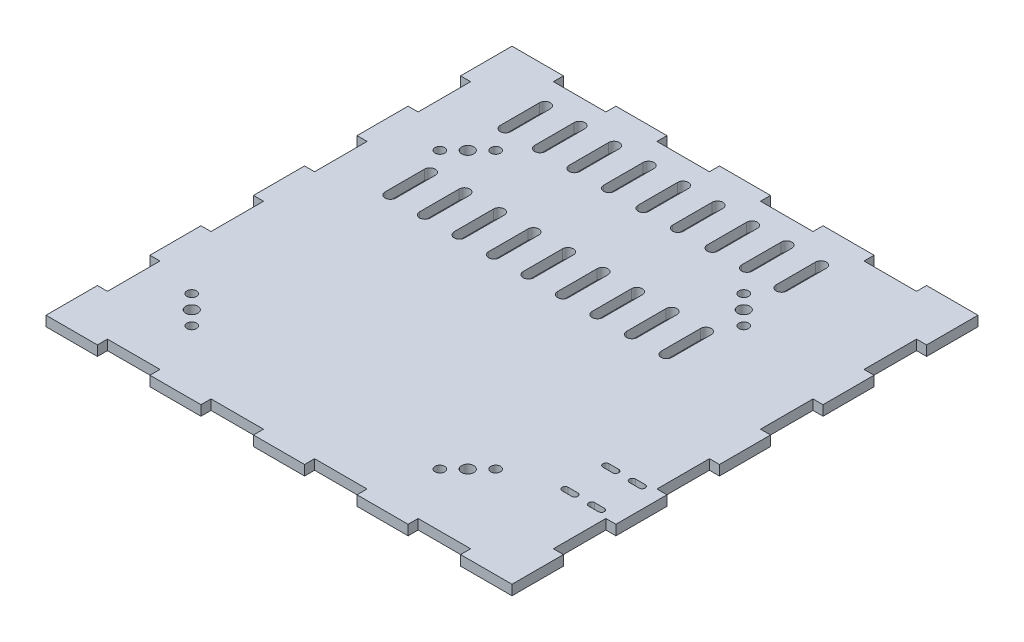
from build123d import *

# Parameters (mm, degrees)
SKETCH2_W           = 130
SKETCH2_H           = 130
SKETCH2_R           = 1.7
BOSS_EXTRUDE1_DEPTH = 2.8
CUT_EXTRUDE2_REACH  = 102.713
SKETCH5_R           = 1.35
SKETCH4_W           = 2.8
SKETCH4_H           = 14.444444445
SKETCH4_W_2         = 14.444444445
SKETCH4_H_2         = 2.8
CUT_EXTRUDE1_DEPTH  = 101.713020509
CUT_EXTRUDE3_REACH  = 102.713
CUT_EXTRUDE4_REACH  = 102.713
TOLERANCE_BY        = 0.1
TOLERANCE_2_BY      = 0.1
TOLERANCE_3_BY      = 0.1
TOLERANCE_4_BY      = 0.1
TOLERANCE_5_BY      = 0.1
TOLERANCE_6_BY      = 0.1
TOLERANCE_7_BY      = 0.1
TOLERANCE_8_BY      = 0.1
TOLERANCE_9_BY      = 0.1
TOLERANCE_10_BY     = 0.1
TOLERANCE_11_BY     = 0.1
TOLERANCE_12_BY     = 0.1
TOLERANCE_13_BY     = 0.1
TOLERANCE_14_BY     = 0.1
TOLERANCE_15_BY     = 0.1
TOLERANCE_16_BY     = 0.1
TOLERANCE_17_BY     = 0.1
TOLERANCE_18_BY     = 0.1
TOLERANCE_19_BY     = 0.1
TOLERANCE_20_BY     = 0.1
TOLERANCE_21_BY     = 0.1
TOLERANCE_22_BY     = 0.1
TOLERANCE_23_BY     = 0.1
TOLERANCE_24_BY     = 0.1
TOLERANCE_25_BY     = 0.1
TOLERANCE_26_BY     = 0.1
TOLERANCE_27_BY     = 0.1
TOLERANCE_28_BY     = 0.1
TOLERANCE_29_BY     = 0.1
TOLERANCE_30_BY     = 0.1
TOLERANCE_31_BY     = 0.1
TOLERANCE_32_BY     = 0.1


with BuildPart() as part:
    # Sketch2 → Boss-Extrude1 (new body)
    with BuildSketch(Plane(origin=(0, 0, 0), x_dir=(1, 0, 0), z_dir=(0, 1, 0))):
        with Locations((7.5, 4.85)):
            Rectangle(SKETCH2_W, SKETCH2_H)
        with Locations(Location((-38.5, 38.5, 0), (0, 0, 270))):
            Circle(SKETCH2_R, mode=Mode.SUBTRACT)
        with Locations(Location((-38.5, -38.5, 0), (0, 0, 270))):
            Circle(SKETCH2_R, mode=Mode.SUBTRACT)
        with Locations(Location((38.5, -38.5, 0), (0, 0, 270))):
            Circle(SKETCH2_R, mode=Mode.SUBTRACT)
        with Locations(Location((38.5, 38.5, 0), (0, 0, 270))):
            Circle(SKETCH2_R, mode=Mode.SUBTRACT)
    extrude(amount=BOSS_EXTRUDE1_DEPTH)

    # Sketch5 → Cut-Extrude2 (cut, up to next)
    with BuildSketch(Plane(origin=(0, 2.8, 0), x_dir=(1, 0, 0), z_dir=(0, 1, 0)), mode=Mode.PRIVATE) as cut_extrude2_sk1:
        with Locations(Location((42.389087297, 34.610912703, 0), (0, 0, 270))):
            Circle(SKETCH5_R)
    cut_extrude2_tool1 = extrude(cut_extrude2_sk1.sketch, amount=-CUT_EXTRUDE2_REACH, mode=Mode.PRIVATE) & part.part
    # Sketch5 → Cut-Extrude2 (cut, up to next)
    with BuildSketch(Plane(origin=(0, 2.8, 0), x_dir=(1, 0, 0), z_dir=(0, 1, 0)), mode=Mode.PRIVATE) as cut_extrude2_sk2:
        with Locations(Location((34.610912703, 42.389087297, 0), (0, 0, 270))):
            Circle(SKETCH5_R)
    cut_extrude2_tool2 = extrude(cut_extrude2_sk2.sketch, amount=-CUT_EXTRUDE2_REACH, mode=Mode.PRIVATE) & part.part
    # Sketch5 → Cut-Extrude2 (cut, up to next)
    with BuildSketch(Plane(origin=(0, 2.8, 0), x_dir=(1, 0, 0), z_dir=(0, 1, 0)), mode=Mode.PRIVATE) as cut_extrude2_sk3:
        with Locations(Location((34.610912703, -42.389087297, 0), (0, 0, 270))):
            Circle(SKETCH5_R)
    cut_extrude2_tool3 = extrude(cut_extrude2_sk3.sketch, amount=-CUT_EXTRUDE2_REACH, mode=Mode.PRIVATE) & part.part
    # Sketch5 → Cut-Extrude2 (cut, up to next)
    with BuildSketch(Plane(origin=(0, 2.8, 0), x_dir=(1, 0, 0), z_dir=(0, 1, 0)), mode=Mode.PRIVATE) as cut_extrude2_sk4:
        with Locations(Location((42.389087297, -34.610912703, 0), (0, 0, 270))):
            Circle(SKETCH5_R)
    cut_extrude2_tool4 = extrude(cut_extrude2_sk4.sketch, amount=-CUT_EXTRUDE2_REACH, mode=Mode.PRIVATE) & part.part
    # Sketch5 → Cut-Extrude2 (cut, up to next)
    with BuildSketch(Plane(origin=(0, 2.8, 0), x_dir=(1, 0, 0), z_dir=(0, 1, 0)), mode=Mode.PRIVATE) as cut_extrude2_sk5:
        with Locations(Location((-42.389087297, -34.610912703, 0), (0, 0, 270))):
            Circle(SKETCH5_R)
    cut_extrude2_tool5 = extrude(cut_extrude2_sk5.sketch, amount=-CUT_EXTRUDE2_REACH, mode=Mode.PRIVATE) & part.part
    # Sketch5 → Cut-Extrude2 (cut, up to next)
    with BuildSketch(Plane(origin=(0, 2.8, 0), x_dir=(1, 0, 0), z_dir=(0, 1, 0)), mode=Mode.PRIVATE) as cut_extrude2_sk6:
        with Locations(Location((-34.610912703, -42.389087297, 0), (0, 0, 270))):
            Circle(SKETCH5_R)
    cut_extrude2_tool6 = extrude(cut_extrude2_sk6.sketch, amount=-CUT_EXTRUDE2_REACH, mode=Mode.PRIVATE) & part.part
    # Sketch5 → Cut-Extrude2 (cut, up to next)
    with BuildSketch(Plane(origin=(0, 2.8, 0), x_dir=(1, 0, 0), z_dir=(0, 1, 0)), mode=Mode.PRIVATE) as cut_extrude2_sk7:
        with Locations(Location((-34.610912703, 42.389087297, 0), (0, 0, 270))):
            Circle(SKETCH5_R)
    cut_extrude2_tool7 = extrude(cut_extrude2_sk7.sketch, amount=-CUT_EXTRUDE2_REACH, mode=Mode.PRIVATE) & part.part
    # Sketch5 → Cut-Extrude2 (cut, up to next)
    with BuildSketch(Plane(origin=(0, 2.8, 0), x_dir=(1, 0, 0), z_dir=(0, 1, 0)), mode=Mode.PRIVATE) as cut_extrude2_sk8:
        with Locations(Location((-42.389087297, 34.610912703, 0), (0, 0, 270))):
            Circle(SKETCH5_R)
    cut_extrude2_tool8 = extrude(cut_extrude2_sk8.sketch, amount=-CUT_EXTRUDE2_REACH, mode=Mode.PRIVATE) & part.part
    add(cut_extrude2_tool1.solids().sort_by_distance((42.389087, 2.8, -34.610913))[0], mode=Mode.SUBTRACT)
    add(cut_extrude2_tool2.solids().sort_by_distance((34.610913, 2.8, -42.389087))[0], mode=Mode.SUBTRACT)
    add(cut_extrude2_tool3.solids().sort_by_distance((34.610913, 2.8, 42.389087))[0], mode=Mode.SUBTRACT)
    add(cut_extrude2_tool4.solids().sort_by_distance((42.389087, 2.8, 34.610913))[0], mode=Mode.SUBTRACT)
    add(cut_extrude2_tool5.solids().sort_by_distance((-42.389087, 2.8, 34.610913))[0], mode=Mode.SUBTRACT)
    add(cut_extrude2_tool6.solids().sort_by_distance((-34.610913, 2.8, 42.389087))[0], mode=Mode.SUBTRACT)
    add(cut_extrude2_tool7.solids().sort_by_distance((-34.610913, 2.8, -42.389087))[0], mode=Mode.SUBTRACT)
    add(cut_extrude2_tool8.solids().sort_by_distance((-42.389087, 2.8, -34.610913))[0], mode=Mode.SUBTRACT)

    # Sketch4 → Cut-Extrude1 (cut, through all)
    with BuildSketch(Plane(origin=(0, 2.8, 0), x_dir=(1, 0, 0), z_dir=(0, 1, 0))):
        with Locations((71.1, 48.183333334)):
            Rectangle(SKETCH4_W, SKETCH4_H)
        with Locations((71.1, 19.294444445)):
            Rectangle(SKETCH4_W, SKETCH4_H)
        with Locations((71.1, -9.594444445)):
            Rectangle(SKETCH4_W, SKETCH4_H)
        with Locations((71.1, -38.483333333)):
            Rectangle(SKETCH4_W, SKETCH4_H)
        with Locations((-35.833333334, -58.75)):
            Rectangle(SKETCH4_W_2, SKETCH4_H_2)
        with Locations((-6.944444445, -58.75)):
            Rectangle(SKETCH4_W_2, SKETCH4_H_2)
        with Locations((21.944444445, -58.75)):
            Rectangle(SKETCH4_W_2, SKETCH4_H_2)
        with Locations((50.833333334, -58.75)):
            Rectangle(SKETCH4_W_2, SKETCH4_H_2)
        with Locations((-56.1, 48.183333334)):
            Rectangle(SKETCH4_W, SKETCH4_H)
        with Locations((-56.1, 19.294444445)):
            Rectangle(SKETCH4_W, SKETCH4_H)
        with Locations((-56.1, -9.594444445)):
            Rectangle(SKETCH4_W, SKETCH4_H)
        with Locations((-56.1, -38.483333333)):
            Rectangle(SKETCH4_W, SKETCH4_H)
        with Locations((50.833333334, 68.45)):
            Rectangle(SKETCH4_W_2, SKETCH4_H_2)
        with Locations((21.944444445, 68.45)):
            Rectangle(SKETCH4_W_2, SKETCH4_H_2)
        with Locations((-6.944444445, 68.45)):
            Rectangle(SKETCH4_W_2, SKETCH4_H_2)
        with Locations((-35.833333334, 68.45)):
            Rectangle(SKETCH4_W_2, SKETCH4_H_2)
    extrude(amount=-CUT_EXTRUDE1_DEPTH, mode=Mode.SUBTRACT)

    # Sketch6 → Cut-Extrude3 (cut, up to next)
    with BuildSketch(Plane(origin=(0, 2.8, 0), x_dir=(1, 0, 0), z_dir=(0, 1, 0)), mode=Mode.PRIVATE) as cut_extrude3_sk1:
        with BuildLine():
            Line((67, -30.588888889), (64.3, -30.588888889))
            ThreePointArc((64.3, -30.588888889), (63.45, -29.738888889), (64.3, -28.888888889))
            Line((64.3, -28.888888889), (67, -28.888888889))
            ThreePointArc((67, -28.888888889), (67.85, -29.738888889), (67, -30.588888889))
        make_face()
    cut_extrude3_tool1 = extrude(cut_extrude3_sk1.sketch, amount=-CUT_EXTRUDE3_REACH, mode=Mode.PRIVATE) & part.part
    # Sketch6 → Cut-Extrude3 (cut, up to next)
    with BuildSketch(Plane(origin=(0, 2.8, 0), x_dir=(1, 0, 0), z_dir=(0, 1, 0)), mode=Mode.PRIVATE) as cut_extrude3_sk2:
        with BuildLine():
            Line((59.6, -30.588888889), (56.9, -30.588888889))
            ThreePointArc((56.9, -30.588888889), (56.05, -29.738888889), (56.9, -28.888888889))
            Line((56.9, -28.888888889), (59.6, -28.888888889))
            ThreePointArc((59.6, -28.888888889), (60.45, -29.738888889), (59.6, -30.588888889))
        make_face()
    cut_extrude3_tool2 = extrude(cut_extrude3_sk2.sketch, amount=-CUT_EXTRUDE3_REACH, mode=Mode.PRIVATE) & part.part
    # Sketch6 → Cut-Extrude3 (cut, up to next)
    with BuildSketch(Plane(origin=(0, 2.8, 0), x_dir=(1, 0, 0), z_dir=(0, 1, 0)), mode=Mode.PRIVATE) as cut_extrude3_sk3:
        with BuildLine():
            Line((59.6, -17.488888889), (56.9, -17.488888889))
            ThreePointArc((56.9, -17.488888889), (56.05, -18.338888889), (56.9, -19.188888889))
            Line((56.9, -19.188888889), (59.6, -19.188888889))
            ThreePointArc((59.6, -19.188888889), (60.45, -18.338888889), (59.6, -17.488888889))
        make_face()
    cut_extrude3_tool3 = extrude(cut_extrude3_sk3.sketch, amount=-CUT_EXTRUDE3_REACH, mode=Mode.PRIVATE) & part.part
    # Sketch6 → Cut-Extrude3 (cut, up to next)
    with BuildSketch(Plane(origin=(0, 2.8, 0), x_dir=(1, 0, 0), z_dir=(0, 1, 0)), mode=Mode.PRIVATE) as cut_extrude3_sk4:
        with BuildLine():
            Line((67, -17.488888889), (64.3, -17.488888889))
            ThreePointArc((64.3, -17.488888889), (63.45, -18.338888889), (64.3, -19.188888889))
            Line((64.3, -19.188888889), (67, -19.188888889))
            ThreePointArc((67, -19.188888889), (67.85, -18.338888889), (67, -17.488888889))
        make_face()
    cut_extrude3_tool4 = extrude(cut_extrude3_sk4.sketch, amount=-CUT_EXTRUDE3_REACH, mode=Mode.PRIVATE) & part.part
    add(cut_extrude3_tool1.solids().sort_by_distance((65.65, 2.8, 29.738889))[0], mode=Mode.SUBTRACT)
    add(cut_extrude3_tool2.solids().sort_by_distance((58.25, 2.8, 29.738889))[0], mode=Mode.SUBTRACT)
    add(cut_extrude3_tool3.solids().sort_by_distance((58.25, 2.8, 18.338889))[0], mode=Mode.SUBTRACT)
    add(cut_extrude3_tool4.solids().sort_by_distance((65.65, 2.8, 18.338889))[0], mode=Mode.SUBTRACT)

    # Sketch7 → Cut-Extrude4 (cut, up to next)
    with BuildSketch(Plane(origin=(0, 2.8, 0), x_dir=(1, 0, 0), z_dir=(0, 1, 0)), mode=Mode.PRIVATE) as cut_extrude4_sk1:
        with BuildLine():
            Line((-37, 60.05), (-37, 49.05))
            ThreePointArc((-37, 49.05), (-38.5, 47.55), (-40, 49.05))
            Line((-40, 49.05), (-40, 60.05))
            ThreePointArc((-40, 60.05), (-38.5, 61.55), (-37, 60.05))
        make_face()
    cut_extrude4_tool1 = extrude(cut_extrude4_sk1.sketch, amount=-CUT_EXTRUDE4_REACH, mode=Mode.PRIVATE) & part.part
    # Sketch7 → Cut-Extrude4 (cut, up to next)
    with BuildSketch(Plane(origin=(0, 2.8, 0), x_dir=(1, 0, 0), z_dir=(0, 1, 0)), mode=Mode.PRIVATE) as cut_extrude4_sk2:
        with BuildLine():
            Line((-30.375, 60.05), (-30.375, 49.05))
            ThreePointArc((-30.375, 49.05), (-28.875, 47.55), (-27.375, 49.05))
            Line((-27.375, 49.05), (-27.375, 60.05))
            ThreePointArc((-27.375, 60.05), (-28.875, 61.55), (-30.375, 60.05))
        make_face()
    cut_extrude4_tool2 = extrude(cut_extrude4_sk2.sketch, amount=-CUT_EXTRUDE4_REACH, mode=Mode.PRIVATE) & part.part
    # Sketch7 → Cut-Extrude4 (cut, up to next)
    with BuildSketch(Plane(origin=(0, 2.8, 0), x_dir=(1, 0, 0), z_dir=(0, 1, 0)), mode=Mode.PRIVATE) as cut_extrude4_sk3:
        with BuildLine():
            Line((-20.75, 60.05), (-20.75, 49.05))
            ThreePointArc((-20.75, 49.05), (-19.25, 47.55), (-17.75, 49.05))
            Line((-17.75, 49.05), (-17.75, 60.05))
            ThreePointArc((-17.75, 60.05), (-19.25, 61.55), (-20.75, 60.05))
        make_face()
    cut_extrude4_tool3 = extrude(cut_extrude4_sk3.sketch, amount=-CUT_EXTRUDE4_REACH, mode=Mode.PRIVATE) & part.part
    # Sketch7 → Cut-Extrude4 (cut, up to next)
    with BuildSketch(Plane(origin=(0, 2.8, 0), x_dir=(1, 0, 0), z_dir=(0, 1, 0)), mode=Mode.PRIVATE) as cut_extrude4_sk4:
        with BuildLine():
            Line((-11.125, 60.05), (-11.125, 49.05))
            ThreePointArc((-11.125, 49.05), (-9.625, 47.55), (-8.125, 49.05))
            Line((-8.125, 49.05), (-8.125, 60.05))
            ThreePointArc((-8.125, 60.05), (-9.625, 61.55), (-11.125, 60.05))
        make_face()
    cut_extrude4_tool4 = extrude(cut_extrude4_sk4.sketch, amount=-CUT_EXTRUDE4_REACH, mode=Mode.PRIVATE) & part.part
    # Sketch7 → Cut-Extrude4 (cut, up to next)
    with BuildSketch(Plane(origin=(0, 2.8, 0), x_dir=(1, 0, 0), z_dir=(0, 1, 0)), mode=Mode.PRIVATE) as cut_extrude4_sk5:
        with BuildLine():
            Line((-1.5, 60.05), (-1.5, 49.05))
            ThreePointArc((-1.5, 49.05), (0, 47.55), (1.5, 49.05))
            Line((1.5, 49.05), (1.5, 60.05))
            ThreePointArc((1.5, 60.05), (0, 61.55), (-1.5, 60.05))
        make_face()
    cut_extrude4_tool5 = extrude(cut_extrude4_sk5.sketch, amount=-CUT_EXTRUDE4_REACH, mode=Mode.PRIVATE) & part.part
    # Sketch7 → Cut-Extrude4 (cut, up to next)
    with BuildSketch(Plane(origin=(0, 2.8, 0), x_dir=(1, 0, 0), z_dir=(0, 1, 0)), mode=Mode.PRIVATE) as cut_extrude4_sk6:
        with BuildLine():
            Line((8.125, 60.05), (8.125, 49.05))
            ThreePointArc((8.125, 49.05), (9.625, 47.55), (11.125, 49.05))
            Line((11.125, 49.05), (11.125, 60.05))
            ThreePointArc((11.125, 60.05), (9.625, 61.55), (8.125, 60.05))
        make_face()
    cut_extrude4_tool6 = extrude(cut_extrude4_sk6.sketch, amount=-CUT_EXTRUDE4_REACH, mode=Mode.PRIVATE) & part.part
    # Sketch7 → Cut-Extrude4 (cut, up to next)
    with BuildSketch(Plane(origin=(0, 2.8, 0), x_dir=(1, 0, 0), z_dir=(0, 1, 0)), mode=Mode.PRIVATE) as cut_extrude4_sk7:
        with BuildLine():
            Line((17.75, 60.05), (17.75, 49.05))
            ThreePointArc((17.75, 49.05), (19.25, 47.55), (20.75, 49.05))
            Line((20.75, 49.05), (20.75, 60.05))
            ThreePointArc((20.75, 60.05), (19.25, 61.55), (17.75, 60.05))
        make_face()
    cut_extrude4_tool7 = extrude(cut_extrude4_sk7.sketch, amount=-CUT_EXTRUDE4_REACH, mode=Mode.PRIVATE) & part.part
    # Sketch7 → Cut-Extrude4 (cut, up to next)
    with BuildSketch(Plane(origin=(0, 2.8, 0), x_dir=(1, 0, 0), z_dir=(0, 1, 0)), mode=Mode.PRIVATE) as cut_extrude4_sk8:
        with BuildLine():
            Line((27.375, 60.05), (27.375, 49.05))
            ThreePointArc((27.375, 49.05), (28.875, 47.55), (30.375, 49.05))
            Line((30.375, 49.05), (30.375, 60.05))
            ThreePointArc((30.375, 60.05), (28.875, 61.55), (27.375, 60.05))
        make_face()
    cut_extrude4_tool8 = extrude(cut_extrude4_sk8.sketch, amount=-CUT_EXTRUDE4_REACH, mode=Mode.PRIVATE) & part.part
    # Sketch7 → Cut-Extrude4 (cut, up to next)
    with BuildSketch(Plane(origin=(0, 2.8, 0), x_dir=(1, 0, 0), z_dir=(0, 1, 0)), mode=Mode.PRIVATE) as cut_extrude4_sk9:
        with BuildLine():
            Line((37, 60.05), (37, 49.05))
            ThreePointArc((37, 49.05), (38.5, 47.55), (40, 49.05))
            Line((40, 49.05), (40, 60.05))
            ThreePointArc((40, 60.05), (38.5, 61.55), (37, 60.05))
        make_face()
    cut_extrude4_tool9 = extrude(cut_extrude4_sk9.sketch, amount=-CUT_EXTRUDE4_REACH, mode=Mode.PRIVATE) & part.part
    # Sketch7 → Cut-Extrude4 (cut, up to next)
    with BuildSketch(Plane(origin=(0, 2.8, 0), x_dir=(1, 0, 0), z_dir=(0, 1, 0)), mode=Mode.PRIVATE) as cut_extrude4_sk10:
        with BuildLine():
            Line((-40, 27.95), (-40, 16.95))
            ThreePointArc((-40, 16.95), (-38.5, 15.45), (-37, 16.95))
            Line((-37, 16.95), (-37, 27.95))
            ThreePointArc((-37, 27.95), (-38.5, 29.45), (-40, 27.95))
        make_face()
    cut_extrude4_tool10 = extrude(cut_extrude4_sk10.sketch, amount=-CUT_EXTRUDE4_REACH, mode=Mode.PRIVATE) & part.part
    # Sketch7 → Cut-Extrude4 (cut, up to next)
    with BuildSketch(Plane(origin=(0, 2.8, 0), x_dir=(1, 0, 0), z_dir=(0, 1, 0)), mode=Mode.PRIVATE) as cut_extrude4_sk11:
        with BuildLine():
            Line((-30.375, 27.95), (-30.375, 16.95))
            ThreePointArc((-30.375, 16.95), (-28.875, 15.45), (-27.375, 16.95))
            Line((-27.375, 16.95), (-27.375, 27.95))
            ThreePointArc((-27.375, 27.95), (-28.875, 29.45), (-30.375, 27.95))
        make_face()
    cut_extrude4_tool11 = extrude(cut_extrude4_sk11.sketch, amount=-CUT_EXTRUDE4_REACH, mode=Mode.PRIVATE) & part.part
    # Sketch7 → Cut-Extrude4 (cut, up to next)
    with BuildSketch(Plane(origin=(0, 2.8, 0), x_dir=(1, 0, 0), z_dir=(0, 1, 0)), mode=Mode.PRIVATE) as cut_extrude4_sk12:
        with BuildLine():
            Line((-20.75, 27.95), (-20.75, 16.95))
            ThreePointArc((-20.75, 16.95), (-19.25, 15.45), (-17.75, 16.95))
            Line((-17.75, 16.95), (-17.75, 27.95))
            ThreePointArc((-17.75, 27.95), (-19.25, 29.45), (-20.75, 27.95))
        make_face()
    cut_extrude4_tool12 = extrude(cut_extrude4_sk12.sketch, amount=-CUT_EXTRUDE4_REACH, mode=Mode.PRIVATE) & part.part
    # Sketch7 → Cut-Extrude4 (cut, up to next)
    with BuildSketch(Plane(origin=(0, 2.8, 0), x_dir=(1, 0, 0), z_dir=(0, 1, 0)), mode=Mode.PRIVATE) as cut_extrude4_sk13:
        with BuildLine():
            Line((-11.125, 27.95), (-11.125, 16.95))
            ThreePointArc((-11.125, 16.95), (-9.625, 15.45), (-8.125, 16.95))
            Line((-8.125, 16.95), (-8.125, 27.95))
            ThreePointArc((-8.125, 27.95), (-9.625, 29.45), (-11.125, 27.95))
        make_face()
    cut_extrude4_tool13 = extrude(cut_extrude4_sk13.sketch, amount=-CUT_EXTRUDE4_REACH, mode=Mode.PRIVATE) & part.part
    # Sketch7 → Cut-Extrude4 (cut, up to next)
    with BuildSketch(Plane(origin=(0, 2.8, 0), x_dir=(1, 0, 0), z_dir=(0, 1, 0)), mode=Mode.PRIVATE) as cut_extrude4_sk14:
        with BuildLine():
            Line((-1.5, 27.95), (-1.5, 16.95))
            ThreePointArc((-1.5, 16.95), (0, 15.45), (1.5, 16.95))
            Line((1.5, 16.95), (1.5, 27.95))
            ThreePointArc((1.5, 27.95), (0, 29.45), (-1.5, 27.95))
        make_face()
    cut_extrude4_tool14 = extrude(cut_extrude4_sk14.sketch, amount=-CUT_EXTRUDE4_REACH, mode=Mode.PRIVATE) & part.part
    # Sketch7 → Cut-Extrude4 (cut, up to next)
    with BuildSketch(Plane(origin=(0, 2.8, 0), x_dir=(1, 0, 0), z_dir=(0, 1, 0)), mode=Mode.PRIVATE) as cut_extrude4_sk15:
        with BuildLine():
            Line((8.125, 27.95), (8.125, 16.95))
            ThreePointArc((8.125, 16.95), (9.625, 15.45), (11.125, 16.95))
            Line((11.125, 16.95), (11.125, 27.95))
            ThreePointArc((11.125, 27.95), (9.625, 29.45), (8.125, 27.95))
        make_face()
    cut_extrude4_tool15 = extrude(cut_extrude4_sk15.sketch, amount=-CUT_EXTRUDE4_REACH, mode=Mode.PRIVATE) & part.part
    # Sketch7 → Cut-Extrude4 (cut, up to next)
    with BuildSketch(Plane(origin=(0, 2.8, 0), x_dir=(1, 0, 0), z_dir=(0, 1, 0)), mode=Mode.PRIVATE) as cut_extrude4_sk16:
        with BuildLine():
            Line((17.75, 27.95), (17.75, 16.95))
            ThreePointArc((17.75, 16.95), (19.25, 15.45), (20.75, 16.95))
            Line((20.75, 16.95), (20.75, 27.95))
            ThreePointArc((20.75, 27.95), (19.25, 29.45), (17.75, 27.95))
        make_face()
    cut_extrude4_tool16 = extrude(cut_extrude4_sk16.sketch, amount=-CUT_EXTRUDE4_REACH, mode=Mode.PRIVATE) & part.part
    # Sketch7 → Cut-Extrude4 (cut, up to next)
    with BuildSketch(Plane(origin=(0, 2.8, 0), x_dir=(1, 0, 0), z_dir=(0, 1, 0)), mode=Mode.PRIVATE) as cut_extrude4_sk17:
        with BuildLine():
            Line((27.375, 27.95), (27.375, 16.95))
            ThreePointArc((27.375, 16.95), (28.875, 15.45), (30.375, 16.95))
            Line((30.375, 16.95), (30.375, 27.95))
            ThreePointArc((30.375, 27.95), (28.875, 29.45), (27.375, 27.95))
        make_face()
    cut_extrude4_tool17 = extrude(cut_extrude4_sk17.sketch, amount=-CUT_EXTRUDE4_REACH, mode=Mode.PRIVATE) & part.part
    # Sketch7 → Cut-Extrude4 (cut, up to next)
    with BuildSketch(Plane(origin=(0, 2.8, 0), x_dir=(1, 0, 0), z_dir=(0, 1, 0)), mode=Mode.PRIVATE) as cut_extrude4_sk18:
        with BuildLine():
            Line((37, 27.95), (37, 16.95))
            ThreePointArc((37, 16.95), (38.5, 15.45), (40, 16.95))
            Line((40, 16.95), (40, 27.95))
            ThreePointArc((40, 27.95), (38.5, 29.45), (37, 27.95))
        make_face()
    cut_extrude4_tool18 = extrude(cut_extrude4_sk18.sketch, amount=-CUT_EXTRUDE4_REACH, mode=Mode.PRIVATE) & part.part
    add(cut_extrude4_tool1.solids().sort_by_distance((-38.5, 2.8, -54.55))[0], mode=Mode.SUBTRACT)
    add(cut_extrude4_tool2.solids().sort_by_distance((-28.875, 2.8, -54.55))[0], mode=Mode.SUBTRACT)
    add(cut_extrude4_tool3.solids().sort_by_distance((-19.25, 2.8, -54.55))[0], mode=Mode.SUBTRACT)
    add(cut_extrude4_tool4.solids().sort_by_distance((-9.625, 2.8, -54.55))[0], mode=Mode.SUBTRACT)
    add(cut_extrude4_tool5.solids().sort_by_distance((0, 2.8, -54.55))[0], mode=Mode.SUBTRACT)
    add(cut_extrude4_tool6.solids().sort_by_distance((9.625, 2.8, -54.55))[0], mode=Mode.SUBTRACT)
    add(cut_extrude4_tool7.solids().sort_by_distance((19.25, 2.8, -54.55))[0], mode=Mode.SUBTRACT)
    add(cut_extrude4_tool8.solids().sort_by_distance((28.875, 2.8, -54.55))[0], mode=Mode.SUBTRACT)
    add(cut_extrude4_tool9.solids().sort_by_distance((38.5, 2.8, -54.55))[0], mode=Mode.SUBTRACT)
    add(cut_extrude4_tool10.solids().sort_by_distance((-38.5, 2.8, -22.45))[0], mode=Mode.SUBTRACT)
    add(cut_extrude4_tool11.solids().sort_by_distance((-28.875, 2.8, -22.45))[0], mode=Mode.SUBTRACT)
    add(cut_extrude4_tool12.solids().sort_by_distance((-19.25, 2.8, -22.45))[0], mode=Mode.SUBTRACT)
    add(cut_extrude4_tool13.solids().sort_by_distance((-9.625, 2.8, -22.45))[0], mode=Mode.SUBTRACT)
    add(cut_extrude4_tool14.solids().sort_by_distance((0, 2.8, -22.45))[0], mode=Mode.SUBTRACT)
    add(cut_extrude4_tool15.solids().sort_by_distance((9.625, 2.8, -22.45))[0], mode=Mode.SUBTRACT)
    add(cut_extrude4_tool16.solids().sort_by_distance((19.25, 2.8, -22.45))[0], mode=Mode.SUBTRACT)
    add(cut_extrude4_tool17.solids().sort_by_distance((28.875, 2.8, -22.45))[0], mode=Mode.SUBTRACT)
    add(cut_extrude4_tool18.solids().sort_by_distance((38.5, 2.8, -22.45))[0], mode=Mode.SUBTRACT)

    # Tolerance: a face moved inward by 0.1
    extrude(part.faces().sort_by_distance((43.611111111, 1.4, -68.45))[0], amount=TOLERANCE_BY, dir=(-1, 0, 0), mode=Mode.SUBTRACT)

    # Tolerance 2: a face moved inward by 0.1
    extrude(part.faces().sort_by_distance((14.722222222, 1.4, -68.45))[0], amount=TOLERANCE_2_BY, dir=(-1, 0, 0), mode=Mode.SUBTRACT)

    # Tolerance 3: a face moved inward by 0.1
    extrude(part.faces().sort_by_distance((-14.166666667, 1.4, -68.45))[0], amount=TOLERANCE_3_BY, dir=(-1, 0, 0), mode=Mode.SUBTRACT)

    # Tolerance 4: a face moved inward by 0.1
    extrude(part.faces().sort_by_distance((-43.055555556, 1.4, -68.45))[0], amount=TOLERANCE_4_BY, dir=(-1, 0, 0), mode=Mode.SUBTRACT)

    # Tolerance 5: a face moved inward by 0.1
    extrude(part.faces().sort_by_distance((29.166666667, 1.4, -68.45))[0], amount=TOLERANCE_5_BY, dir=(1, 0, 0), mode=Mode.SUBTRACT)

    # Tolerance 6: a face moved inward by 0.1
    extrude(part.faces().sort_by_distance((58.055555556, 1.4, -68.45))[0], amount=TOLERANCE_6_BY, dir=(1, 0, 0), mode=Mode.SUBTRACT)

    # Tolerance 7: a face moved inward by 0.1
    extrude(part.faces().sort_by_distance((0.277777778, 1.4, -68.45))[0], amount=TOLERANCE_7_BY, dir=(1, 0, 0), mode=Mode.SUBTRACT)

    # Tolerance 8: a face moved inward by 0.1
    extrude(part.faces().sort_by_distance((-28.611111111, 1.4, -68.45))[0], amount=TOLERANCE_8_BY, dir=(1, 0, 0), mode=Mode.SUBTRACT)

    # Tolerance 9: a face moved inward by 0.1
    extrude(part.faces().sort_by_distance((-56.1, 1.4, -40.961111111))[0], amount=TOLERANCE_9_BY, dir=(0, 0, 1), mode=Mode.SUBTRACT)

    # Tolerance 10: a face moved inward by 0.1
    extrude(part.faces().sort_by_distance((-56.1, 1.4, -55.405555556))[0], amount=TOLERANCE_10_BY, dir=(0, 0, -1), mode=Mode.SUBTRACT)

    # Tolerance 11: a face moved inward by 0.1
    extrude(part.faces().sort_by_distance((-56.1, 1.4, -12.072222222))[0], amount=TOLERANCE_11_BY, dir=(0, 0, 1), mode=Mode.SUBTRACT)

    # Tolerance 12: a face moved inward by 0.1
    extrude(part.faces().sort_by_distance((-56.1, 1.4, -26.516666667))[0], amount=TOLERANCE_12_BY, dir=(0, 0, -1), mode=Mode.SUBTRACT)

    # Tolerance 13: a face moved inward by 0.1
    extrude(part.faces().sort_by_distance((-56.1, 1.4, 2.372222222))[0], amount=TOLERANCE_13_BY, dir=(0, 0, -1), mode=Mode.SUBTRACT)

    # Tolerance 14: a face moved inward by 0.1
    extrude(part.faces().sort_by_distance((-56.1, 1.4, 16.816666667))[0], amount=TOLERANCE_14_BY, dir=(0, 0, 1), mode=Mode.SUBTRACT)

    # Tolerance 15: a face moved inward by 0.1
    extrude(part.faces().sort_by_distance((-56.1, 1.4, 45.705555556))[0], amount=TOLERANCE_15_BY, dir=(0, 0, 1), mode=Mode.SUBTRACT)

    # Tolerance 16: a face moved inward by 0.1
    extrude(part.faces().sort_by_distance((-56.1, 1.4, 31.261111111))[0], amount=TOLERANCE_16_BY, dir=(0, 0, -1), mode=Mode.SUBTRACT)

    # Tolerance 17: a face moved inward by 0.1
    extrude(part.faces().sort_by_distance((-28.611111111, 1.4, 58.75))[0], amount=TOLERANCE_17_BY, dir=(1, 0, 0), mode=Mode.SUBTRACT)

    # Tolerance 18: a face moved inward by 0.1
    extrude(part.faces().sort_by_distance((-43.055555556, 1.4, 58.75))[0], amount=TOLERANCE_18_BY, dir=(-1, 0, 0), mode=Mode.SUBTRACT)

    # Tolerance 19: a face moved inward by 0.1
    extrude(part.faces().sort_by_distance((-14.166666667, 1.4, 58.75))[0], amount=TOLERANCE_19_BY, dir=(-1, 0, 0), mode=Mode.SUBTRACT)

    # Tolerance 20: a face moved inward by 0.1
    extrude(part.faces().sort_by_distance((0.277777778, 1.4, 58.75))[0], amount=TOLERANCE_20_BY, dir=(1, 0, 0), mode=Mode.SUBTRACT)

    # Tolerance 21: a face moved inward by 0.1
    extrude(part.faces().sort_by_distance((14.722222222, 1.4, 58.75))[0], amount=TOLERANCE_21_BY, dir=(-1, 0, 0), mode=Mode.SUBTRACT)

    # Tolerance 22: a face moved inward by 0.1
    extrude(part.faces().sort_by_distance((29.166666667, 1.4, 58.75))[0], amount=TOLERANCE_22_BY, dir=(1, 0, 0), mode=Mode.SUBTRACT)

    # Tolerance 23: a face moved inward by 0.1
    extrude(part.faces().sort_by_distance((58.055555556, 1.4, 58.75))[0], amount=TOLERANCE_23_BY, dir=(1, 0, 0), mode=Mode.SUBTRACT)

    # Tolerance 24: a face moved inward by 0.1
    extrude(part.faces().sort_by_distance((43.611111111, 1.4, 58.75))[0], amount=TOLERANCE_24_BY, dir=(-1, 0, 0), mode=Mode.SUBTRACT)

    # Tolerance 25: a face moved inward by 0.1
    extrude(part.faces().sort_by_distance((71.1, 1.4, 31.261111111))[0], amount=TOLERANCE_25_BY, dir=(0, 0, -1), mode=Mode.SUBTRACT)

    # Tolerance 26: a face moved inward by 0.1
    extrude(part.faces().sort_by_distance((71.1, 1.4, 45.705555556))[0], amount=TOLERANCE_26_BY, dir=(0, 0, 1), mode=Mode.SUBTRACT)

    # Tolerance 27: a face moved inward by 0.1
    extrude(part.faces().sort_by_distance((71.1, 1.4, 16.816666667))[0], amount=TOLERANCE_27_BY, dir=(0, 0, 1), mode=Mode.SUBTRACT)

    # Tolerance 28: a face moved inward by 0.1
    extrude(part.faces().sort_by_distance((71.1, 1.4, 2.372222222))[0], amount=TOLERANCE_28_BY, dir=(0, 0, -1), mode=Mode.SUBTRACT)

    # Tolerance 29: a face moved inward by 0.1
    extrude(part.faces().sort_by_distance((71.1, 1.4, -12.072222222))[0], amount=TOLERANCE_29_BY, dir=(0, 0, 1), mode=Mode.SUBTRACT)

    # Tolerance 30: a face moved inward by 0.1
    extrude(part.faces().sort_by_distance((71.1, 1.4, -26.516666667))[0], amount=TOLERANCE_30_BY, dir=(0, 0, -1), mode=Mode.SUBTRACT)

    # Tolerance 31: a face moved inward by 0.1
    extrude(part.faces().sort_by_distance((71.1, 1.4, -55.405555556))[0], amount=TOLERANCE_31_BY, dir=(0, 0, -1), mode=Mode.SUBTRACT)

    # Tolerance 32: a face moved inward by 0.1
    extrude(part.faces().sort_by_distance((71.1, 1.4, -40.961111111))[0], amount=TOLERANCE_32_BY, dir=(0, 0, 1), mode=Mode.SUBTRACT)


solid = part.part
